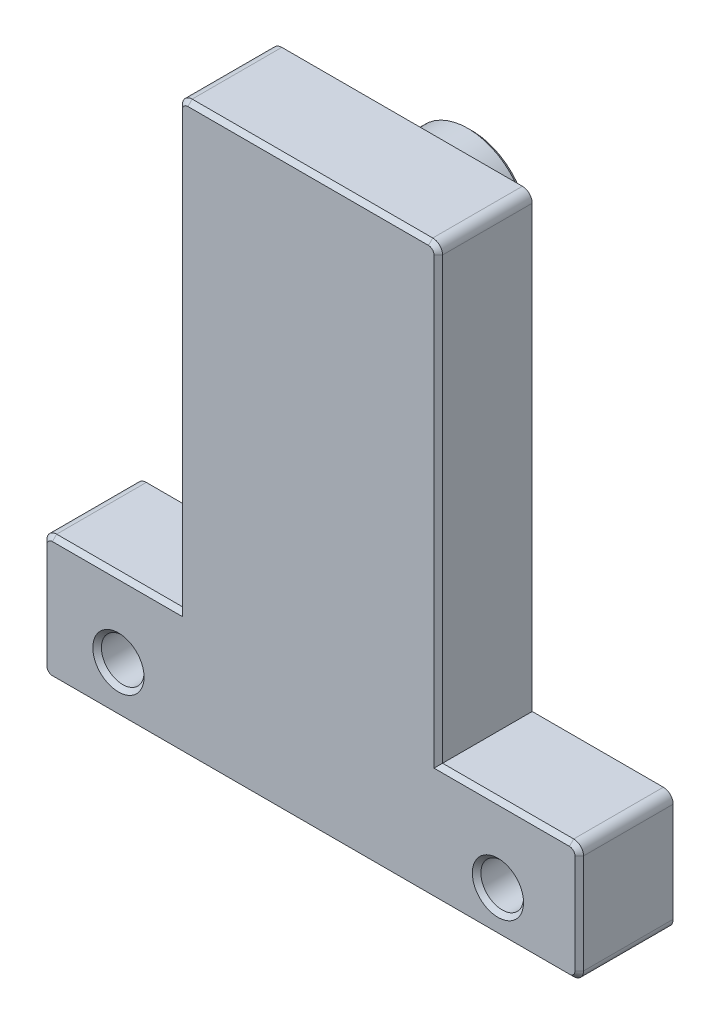
from build123d import *

# Parameters (mm, degrees)
EXTRUDE_1_DEPTH     = 2.2
FILLET_1_R          = 0.23
SKETCH_4_R          = 1.41
EXTRUDE_2_DEPTH     = 1.65
CHAMFER_1_SIZE      = 0.1
SKETCH_5_R          = 0.5
CUT_EXTRUDE_1_DEPTH = 2.2
CHAMFER_2_SIZE      = 0.1


with BuildPart() as part:
    # 草图2 → 凸台-拉伸1 (new body)
    with BuildSketch(Plane.XY):
        Polygon((73.787, 72.009), (76.962, 72.009), (76.962, 82.423), (83.058, 82.423), (83.058, 71.882), (86.36, 71.882), (86.36, 69.088), (82.804, 69.088), (77.343, 69.088), (73.787, 69.088), align=None)
    extrude(amount=EXTRUDE_1_DEPTH)

    # 圆角1
    fillet_1_edges = [part.edges().sort_by_distance(p)[0] for p in [
        (73.787, 72.009, 1.1),
        (76.962, 82.423, 1.1),
        (83.058, 82.423, 1.1),
        (86.36, 71.882, 1.1),
        (86.36, 69.088, 1.1),
        (73.787, 69.088, 1.1),
    ]]
    fillet(fillet_1_edges, radius=FILLET_1_R)

    # 草图4 → 凸台-拉伸2 (add)
    with BuildSketch(Plane.XY):
        with Locations(Location((80.00000002, 80.00000002, 0), (0, 0, 180))):
            Circle(SKETCH_4_R)
    extrude(amount=-EXTRUDE_2_DEPTH)

    # 倒角1
    chamfer_1_edges = [part.edges().sort_by_distance(p)[0] for p in [
        (83.058, 77.0375, 2.2),
        (80.0735, 69.088, 2.2),
        (73.787, 70.5485, 2.2),
        (75.4895, 72.009, 2.2),
        (86.36, 70.485, 2.2),
        (84.594, 71.882, 2.2),
        (80.01, 82.423, 2.2),
        (76.962, 77.101, 2.2),
        (86.29263456, 71.81463456, 2.2),
        (86.29263456, 69.15536544, 2.2),
        (82.99063456, 82.35563456, 2.2),
        (77.02936544, 82.35563456, 2.2),
        (73.85436544, 71.94163456, 2.2),
        (73.85436544, 69.15536544, 2.2),
        (81.41000002, 80.00000002, -1.65),
    ]]
    chamfer(chamfer_1_edges, length=CHAMFER_1_SIZE)

    # 草图5 → 切除-拉伸1 (cut)
    with BuildSketch(Plane.XY):
        with Locations(Location((75.565, 70.231, 0), (0, 0, 180))):
            Circle(SKETCH_5_R)
        with Locations(Location((84.455, 70.104, 0), (0, 0, 180))):
            Circle(SKETCH_5_R)
    extrude(amount=CUT_EXTRUDE_1_DEPTH, mode=Mode.SUBTRACT)

    # 倒角2
    chamfer_2_edges = [part.edges().sort_by_distance(p)[0] for p in [
        (76.065, 70.231, 2.2),
        (84.955, 70.104, 2.2),
    ]]
    chamfer(chamfer_2_edges, length=CHAMFER_2_SIZE)


solid = part.part
